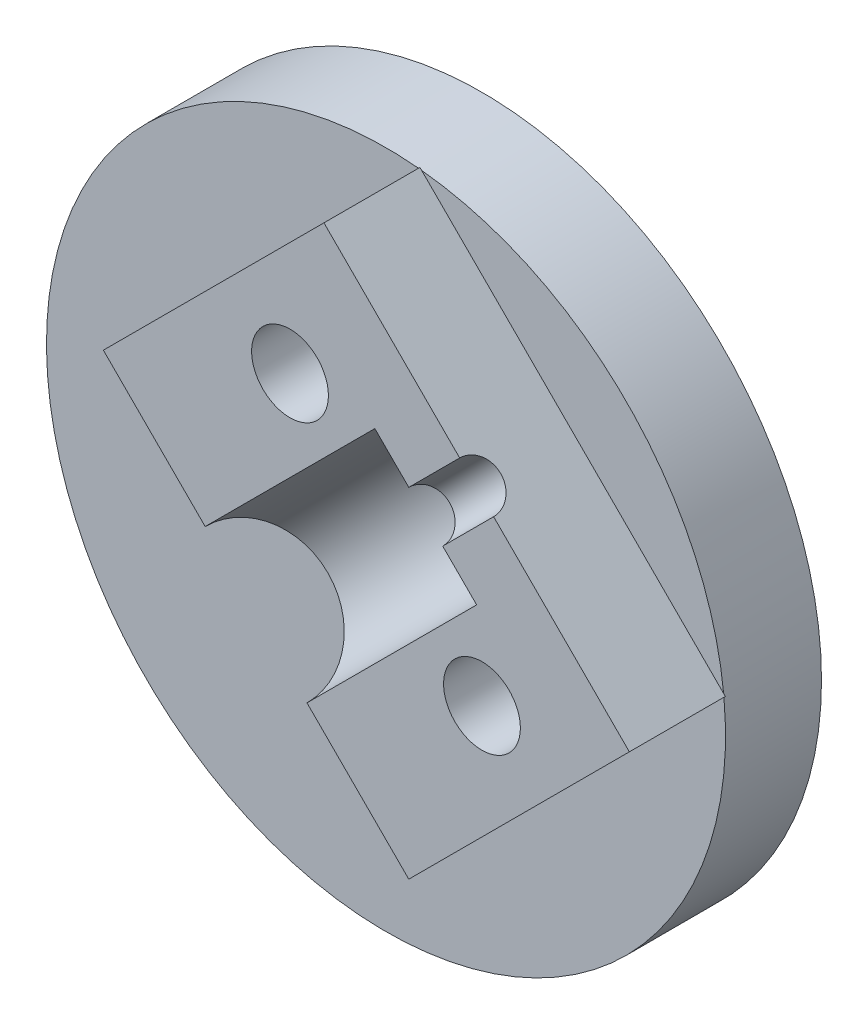
from build123d import *

# Parameters (mm, degrees)
SKETCH_1_R           = 14.149308539
SKETCH_1_R_2         = 1.6
EXTRUDE_1_DEPTH      = 4
EXTRUDE_2_DEPTH      = 11
EXTRUDE_2_DEPTH_BACK = 2
CUT_EXTRUDE_START    = -10
SKETCH_4_R           = 1.6
CUT_EXTRUDE_1_DEPTH  = 10
EXTRUDE_START        = -3
EXTRUDE_3_DEPTH      = 3


with BuildPart() as part:
    # 草图1 → 凸台-拉伸1 (new body)
    with BuildSketch(Plane.XY):
        Circle(SKETCH_1_R)
        with Locations((0, -8)):
            Circle(SKETCH_1_R_2, mode=Mode.SUBTRACT)
        with Locations((8, 0)):
            Circle(SKETCH_1_R_2, mode=Mode.SUBTRACT)
        with Locations((0, 8)):
            Circle(SKETCH_1_R_2, mode=Mode.SUBTRACT)
        with Locations((-8, 0)):
            Circle(SKETCH_1_R_2, mode=Mode.SUBTRACT)
    extrude(amount=EXTRUDE_1_DEPTH)

    # 草图3 → 凸台-拉伸2 (add, two sides: drawn at the far end of the back side and taken through both)
    with BuildSketch(Plane(origin=(0, 0, 0), x_dir=(0, 0, -1), z_dir=(0.7071067811865488, 0.7071067811865464, 0)).offset(-EXTRUDE_2_DEPTH_BACK)):
        with BuildLine():
            Line((-8, 9), (-8, 3))
            ThreePointArc((-8, 3), (-5.878679656, 2.121320344), (-5, 0))
            ThreePointArc((-5, 0), (-5.878679656, -2.121320344), (-8, -3))
            Line((-8, -3), (-8, -9))
            Line((-8, -9), (-4, -9))
            Line((-4, -9), (-4, 9))
            Line((-4, 9), (-8, 9))
        make_face()
    extrude(amount=EXTRUDE_2_DEPTH + EXTRUDE_2_DEPTH_BACK)

    # 草图4 → 切除-拉伸1 (cut)
    with BuildSketch(Plane.XY.offset(8).offset(CUT_EXTRUDE_START)):
        with Locations((8, 0)):
            Circle(SKETCH_4_R)
        with Locations((0, 8)):
            Circle(SKETCH_4_R)
    extrude(amount=CUT_EXTRUDE_1_DEPTH, mode=Mode.SUBTRACT)

    # 草图5 → 凸台-拉伸3 (add)
    with BuildSketch(Plane(origin=(7.778174593, 7.778174593, 0), x_dir=(0, 0, -1), z_dir=(0.7071067811865486, 0.7071067811865465, 0)).offset(EXTRUDE_START)):
        with BuildLine():
            Line((-8, -1), (-8, -3))
            ThreePointArc((-8, -3), (-5.878679656, -2.121320344), (-5, 0))
            ThreePointArc((-5, 0), (-5.878679656, 2.121320344), (-8, 3))
            Line((-8, 3), (-8, 1))
            ThreePointArc((-8, 1), (-7.292893219, 0.707106781), (-7, 0))
            ThreePointArc((-7, 0), (-7.292893219, -0.707106781), (-8, -1))
        make_face()
    extrude(amount=EXTRUDE_3_DEPTH)


solid = part.part
